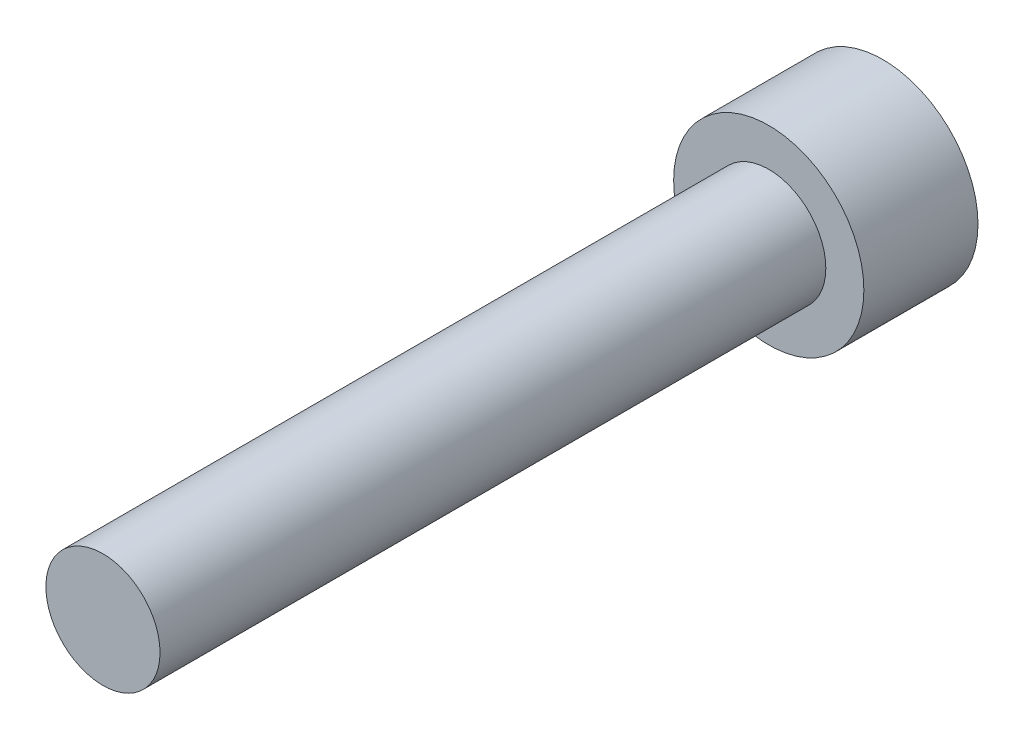
from build123d import *

# Parameters (mm, degrees)
HEAD_ENVELOPE_START         = -6
SKETCH1_R                   = 5
HEAD_ENVELOPE_DEPTH         = 6
SKETCH2_R                   = 3
THREAD_MAJOR_ENVELOPE_DEPTH = 35


with BuildPart() as part:
    # Sketch1 → Head_Envelope (new body)
    with BuildSketch(Plane.XY.offset(HEAD_ENVELOPE_START)):
        Circle(SKETCH1_R)
    extrude(amount=HEAD_ENVELOPE_DEPTH)

    # Sketch2 → Thread_Major_Envelope (add)
    with BuildSketch(Plane.XY):
        Circle(SKETCH2_R)
    extrude(amount=THREAD_MAJOR_ENVELOPE_DEPTH)


solid = part.part
